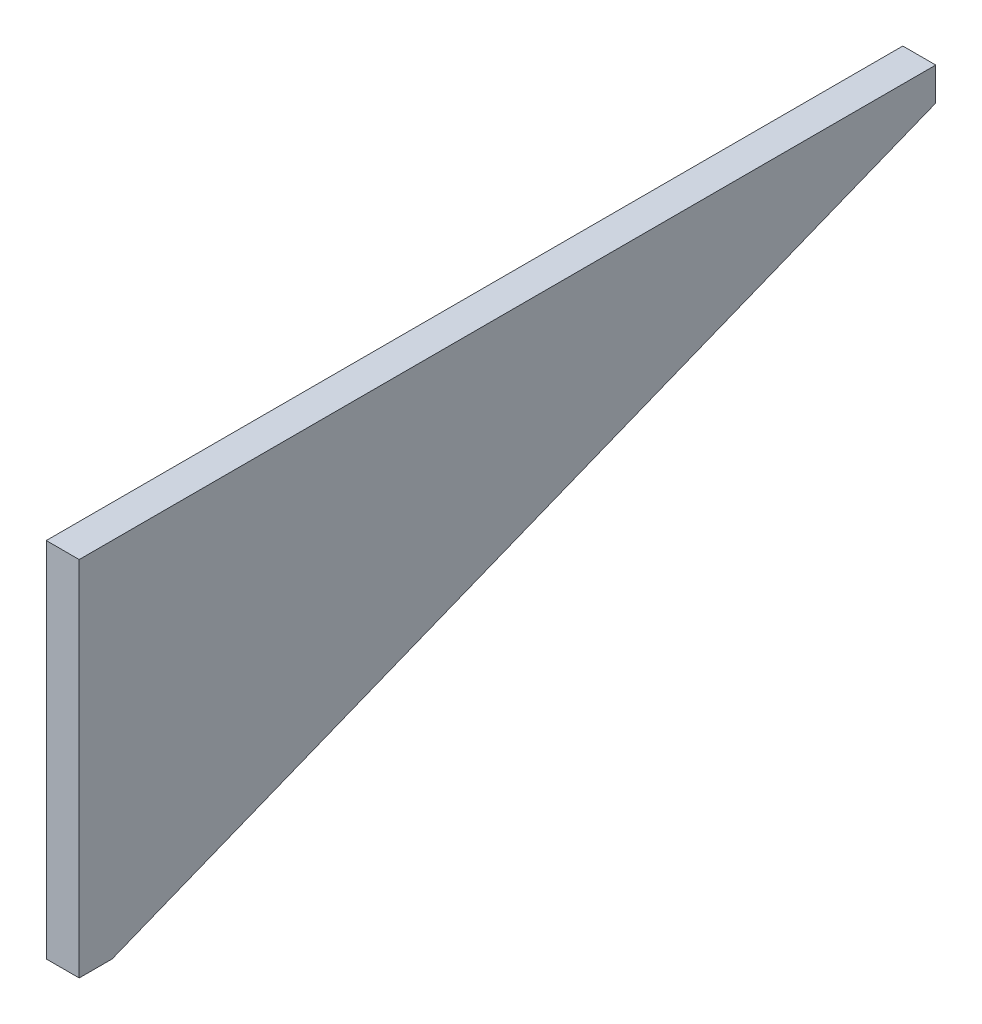
from build123d import *

# Parameters (mm, degrees)
BOSS_EXTRUDE1_DEPTH = 2


with BuildPart() as part:
    # Sketch1 → Boss-Extrude1 (new body)
    with BuildSketch(Plane(origin=(0, 0, 0), x_dir=(0, 0, -1), z_dir=(1, 0, 0))):
        Polygon((0, 0), (52, 0), (52, -2), (2, -22), (0, -22), align=None)
    extrude(amount=BOSS_EXTRUDE1_DEPTH)


solid = part.part
